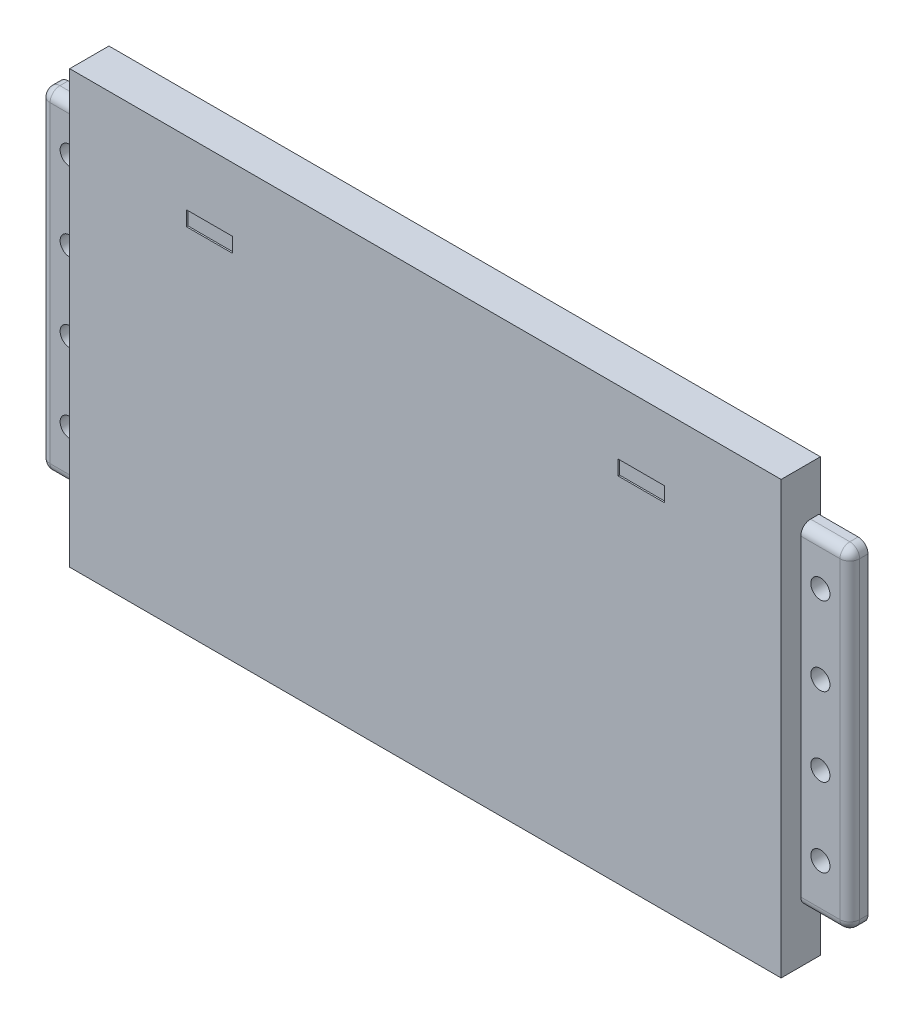
from build123d import *

# Parameters (mm, degrees)
SKETCH1_W            = 1450
SKETCH1_H            = 880
BOSS_EXTRUDE1_DEPTH  = 40
SHELL1_T             = 3
SKETCH2_W            = 94
SKETCH2_H            = 30
CUT_EXTRUDE1_DEPTH   = 118
SKETCH3_W            = 37
SKETCH3_H            = 677
BOSS_EXTRUDE2_DEPTH  = 100
FILLET1_R            = 20
SKETCH4_R            = 19.494294984
CUT_EXTRUDE2_DEPTH   = 100
FILLET1_OF_MIRROR1_R = 20


with BuildPart() as part:
    # Sketch1 → Boss-Extrude1 (new, symmetric)
    with BuildSketch(Plane.XY):
        Rectangle(SKETCH1_W, SKETCH1_H)
    extrude(amount=BOSS_EXTRUDE1_DEPTH, both=True)

    # Shell1 (no face opened: a closed hollow body)
    add(offset(amount=-SHELL1_T, mode=Mode.PRIVATE), mode=Mode.SUBTRACT)

    # Sketch2 → Cut-Extrude1 (cut)
    with BuildSketch(Plane.XY):
        with Locations((-440, 295)):
            Rectangle(SKETCH2_W, SKETCH2_H)
        with Locations((440, 295)):
            Rectangle(SKETCH2_W, SKETCH2_H)
    extrude(amount=CUT_EXTRUDE1_DEPTH, mode=Mode.SUBTRACT)

    # Sketch3 → Boss-Extrude2 (add)
    with BuildSketch(Plane(origin=(725, 0, 0), x_dir=(0, 0, -1), z_dir=(1, 0, 0))):
        with Locations((18.5, 1.5)):
            Rectangle(SKETCH3_W, SKETCH3_H)
    boss_extrude2 = extrude(amount=BOSS_EXTRUDE2_DEPTH)

    # Fillet1
    fillet1_edges = [part.edges().sort_by_distance(p)[0] for p in [
        (775, 340, 0),
        (775, -337, 0),
        (825, 340, -18.5),
        (825, 1.5, 0),
        (825, -337, -18.5),
    ]]
    fillet(fillet1_edges, radius=FILLET1_R)

    # Sketch4 → Cut-Extrude2 (cut)
    with BuildSketch(Plane.XY):
        with Locations((765, 246.927736461)):
            Circle(SKETCH4_R)
        with Locations((765, 86.927736461)):
            Circle(SKETCH4_R)
        with Locations((765, -73.072263539)):
            Circle(SKETCH4_R)
        with Locations((765, -233.072263539)):
            Circle(SKETCH4_R)
    cut_extrude2 = extrude(amount=-CUT_EXTRUDE2_DEPTH, mode=Mode.SUBTRACT)

    # Mirror1: Boss-Extrude2, Cut-Extrude2 across plane
    add(boss_extrude2.mirror(Plane(origin=(0, 0, 0), x_dir=(0, 0, 1), z_dir=(1, 0, 0))))
    add(cut_extrude2.mirror(Plane(origin=(0, 0, 0), x_dir=(0, 0, 1), z_dir=(1, 0, 0))), mode=Mode.SUBTRACT)

    # Fillet1 of Mirror1
    fillet1_of_mirror1_edges = [part.edges().sort_by_distance(p)[0] for p in [
        (-775, 340, 0),
        (-775, -337, 0),
        (-825, 340, -18.5),
        (-825, 1.5, 0),
        (-825, -337, -18.5),
    ]]
    fillet(fillet1_of_mirror1_edges, radius=FILLET1_OF_MIRROR1_R)


solid = part.part
